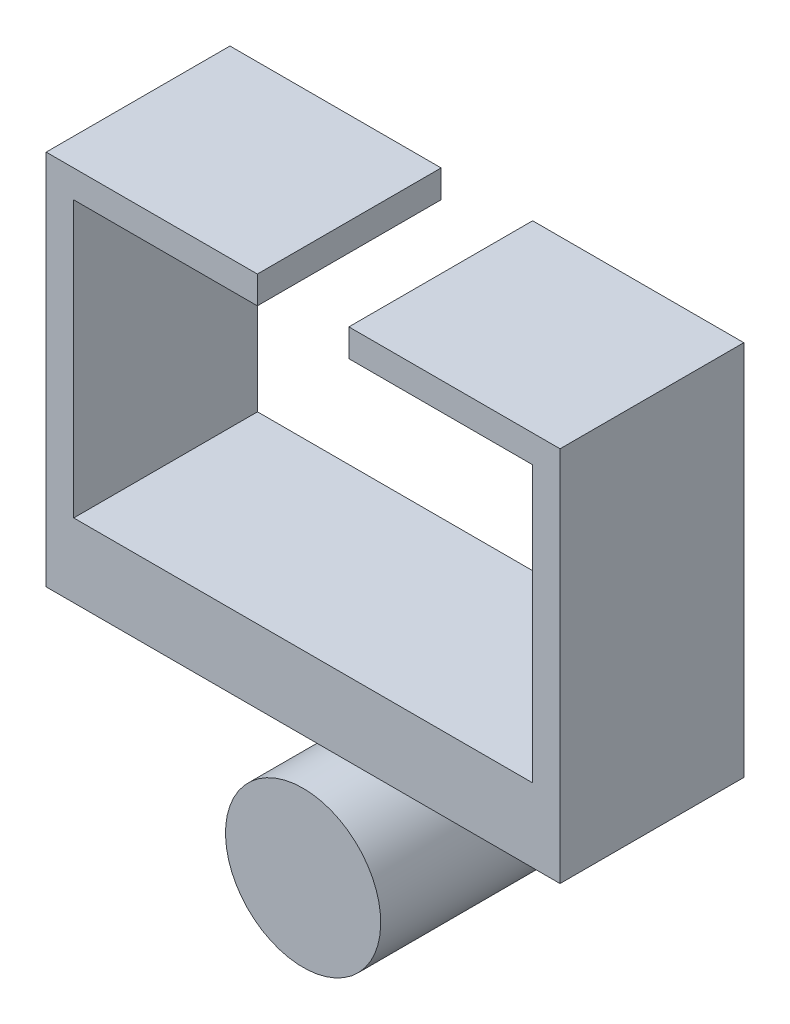
from build123d import *

# Parameters (mm, degrees)
SKETCH1_R             = 10.728678925
BOSS_EXTRUDE1_DEPTH   = 25.4
BOSS_EXTRUDE1_2_DEPTH = 25.4
SKETCH2_W             = 21.45735785
SKETCH2_H             = 6.35
BOSS_EXTRUDE2_DEPTH   = 17.0688


with BuildPart() as part:
    # Sketch1 → Boss-Extrude1 (new body)
    with BuildSketch(Plane.XY):
        Circle(SKETCH1_R)
    extrude(amount=BOSS_EXTRUDE1_DEPTH)



with BuildPart() as body_2:
    # Sketch1 → Boss-Extrude1 2 (new body)
    with BuildSketch(Plane.XY):
        Polygon((-35.51174, 17.0688), (35.51174, 17.0688), (35.51174, 69.1134), (6.3246, 69.1134), (6.3246, 65.3034), (31.70428, 65.3034), (31.70428, 27.2288), (-31.70428, 27.2288), (-31.70428, 65.3034), (-6.3246, 65.3034), (-6.3246, 69.1134), (-35.51174, 69.1134), align=None)
    extrude(amount=BOSS_EXTRUDE1_2_DEPTH)


with BuildPart() as part_1:
    add(part.part)

    add(body_2.part)  # Boss-Extrude2 merges body 2
    # Sketch2 → Boss-Extrude2 (add)
    with BuildSketch(Plane.XZ.offset(-17.0688)):
        with Locations((0, 3.175)):
            Rectangle(SKETCH2_W, SKETCH2_H)
    extrude(amount=BOSS_EXTRUDE2_DEPTH)


solid = part_1.part
